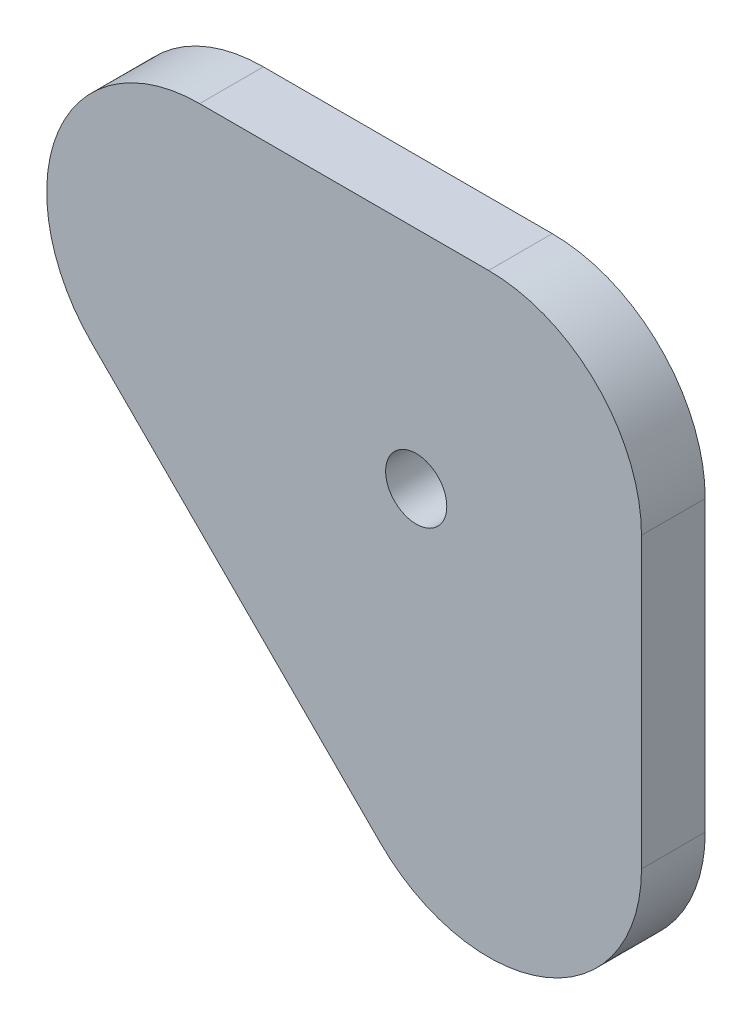
from build123d import *

# Parameters (mm, degrees)
SKETCH1_R           = 2.4
BOSS_EXTRUDE1_DEPTH = 5


with BuildPart() as part:
    # Sketch1 → Boss-Extrude1 (new body)
    with BuildSketch(Plane.XY):
        with BuildLine():
            Line((-69.477058106, -61.158244655), (-92.146105665, -61.158244655))
            ThreePointArc((-92.146105665, -61.158244655), (-103.232660055, -68.566043467), (-100.631387039, -81.64352603))
            Line((-100.631387039, -81.64352603), (-77.962339481, -104.312573588))
            ThreePointArc((-77.962339481, -104.312573588), (-64.884856918, -106.913846604), (-57.477058106, -95.827292214))
            Line((-57.477058106, -95.827292214), (-57.477058106, -73.158244655))
            ThreePointArc((-57.477058106, -73.158244655), (-60.991776732, -64.672963281), (-69.477058106, -61.158244655))
        make_face()
        with Locations((-75.154727636, -78.835914185)):
            Circle(SKETCH1_R, mode=Mode.SUBTRACT)
    extrude(amount=BOSS_EXTRUDE1_DEPTH)


solid = part.part
